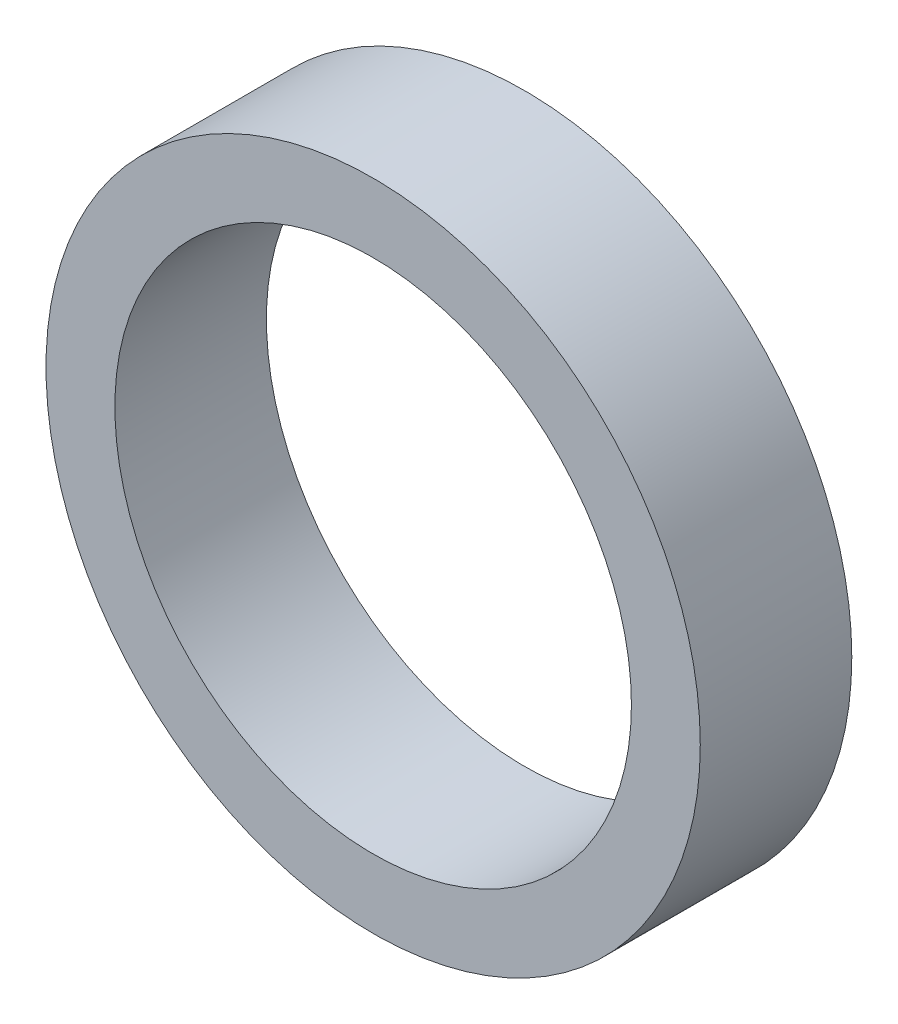
from build123d import *

# Parameters (mm, degrees)
SKETCH1_R           = 12.065
SKETCH1_R_2         = 9.525
BOSS_EXTRUDE1_DEPTH = 5.588


with BuildPart() as part:
    # Sketch1 → Boss-Extrude1 (new body)
    with BuildSketch(Plane.XY):
        Circle(SKETCH1_R)
        Circle(SKETCH1_R_2, mode=Mode.SUBTRACT)
    extrude(amount=BOSS_EXTRUDE1_DEPTH)


solid = part.part
